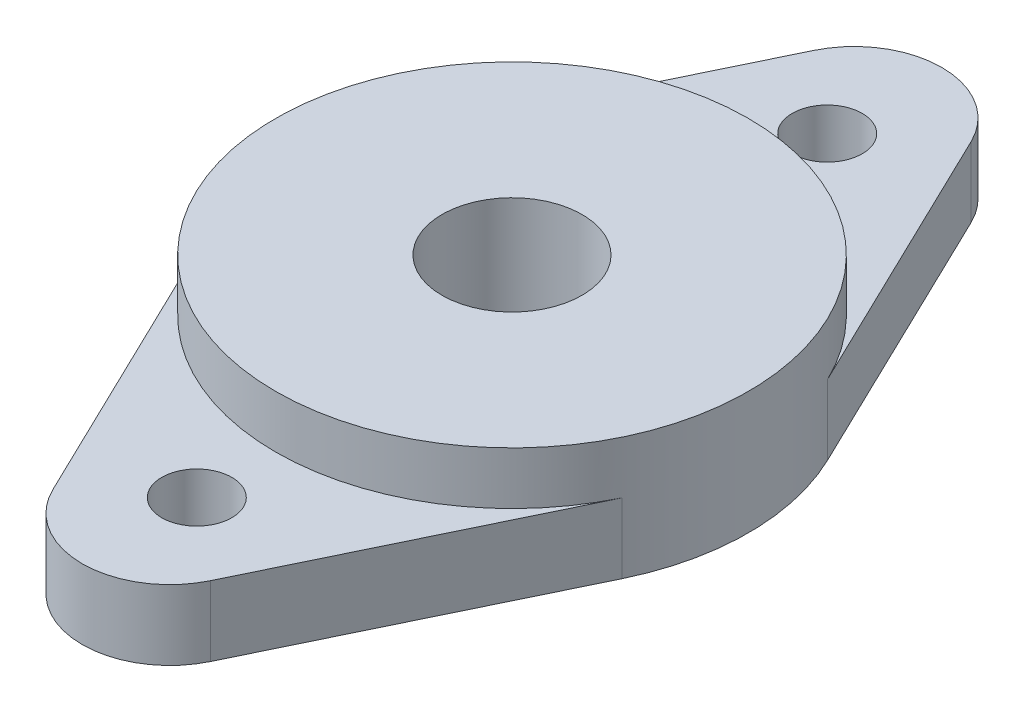
from build123d import *

# Parameters (mm, degrees)
BOSS_EXTRUDE1_DEPTH = 4
SKETCH2_R           = 2
CUT_EXTRUDE1_DEPTH  = 29.296371725
SKETCH3_R           = 13.5
BOSS_EXTRUDE2_DEPTH = 3
SKETCH4_R           = 4
CUT_EXTRUDE2_DEPTH  = 29.87359785


with BuildPart() as part:
    # Sketch1 → Boss-Extrude1 (new body)
    with BuildSketch(Plane(origin=(0, 0, 0), x_dir=(1, 0, 0), z_dir=(0, 1, 0))):
        with BuildLine():
            ThreePointArc((13.5, 0), (13.159823391, 3.011486067), (12.156437284, 5.871203671))
            ThreePointArc((12.156437284, 5.871203671), (0, 13.5), (-12.156437284, 5.871203671))
            ThreePointArc((-12.156437284, 5.871203671), (-13.159823391, 3.011486067), (-13.5, 0))
            Line((-13.5, 0), (13.5, 0))
        make_face()
        with BuildLine():
            ThreePointArc((12.156437284, -5.871203671), (13.159823391, -3.011486067), (13.5, 0))
            Line((13.5, 0), (-13.5, 0))
            ThreePointArc((-13.5, 0), (-13.159823391, -3.011486067), (-12.156437284, -5.871203671))
            ThreePointArc((-12.156437284, -5.871203671), (0, -13.5), (12.156437284, -5.871203671))
        make_face()
        with BuildLine():
            ThreePointArc((-12.156437284, 5.871203671), (0, 13.5), (12.156437284, 5.871203671))
            Line((12.156437284, 5.871203671), (4.502384179, 21.719064136))
            ThreePointArc((4.502384179, 21.719064136), (0, 24.544544258), (-4.502384179, 21.719064136))
            Line((-4.502384179, 21.719064136), (-12.156437284, 5.871203671))
        make_face()
        with BuildLine():
            Line((4.502384179, -21.719064136), (12.156437284, -5.871203671))
            ThreePointArc((12.156437284, -5.871203671), (0, -13.5), (-12.156437284, -5.871203671))
            Line((-12.156437284, -5.871203671), (-4.502384179, -21.719064136))
            ThreePointArc((-4.502384179, -21.719064136), (0, -24.544544258), (4.502384179, -21.719064136))
        make_face()
    extrude(amount=BOSS_EXTRUDE1_DEPTH)

    # Sketch2 → Cut-Extrude1 (cut, through all)
    with BuildSketch(Plane(origin=(0, 4, 0), x_dir=(1, 0, 0), z_dir=(0, 1, 0))):
        with Locations(Location((0, -18, 0), (0, 0, 270))):
            Circle(SKETCH2_R)
        with Locations(Location((0, 18, 0), (0, 0, 270))):
            Circle(SKETCH2_R)
    extrude(amount=-CUT_EXTRUDE1_DEPTH, mode=Mode.SUBTRACT)

    # Sketch3 → Boss-Extrude2 (add)
    with BuildSketch(Plane(origin=(0, 4, 0), x_dir=(1, 0, 0), z_dir=(0, 1, 0))):
        with Locations(Location((0, 0, 0), (0, 0, 25.779183858))):
            Circle(SKETCH3_R)
    extrude(amount=BOSS_EXTRUDE2_DEPTH)

    # Sketch4 → Cut-Extrude2 (cut, through all)
    with BuildSketch(Plane(origin=(0, 7, 0), x_dir=(1, 0, 0), z_dir=(0, 1, 0))):
        with Locations(Location((0, 0, 0), (0, 0, 270))):
            Circle(SKETCH4_R)
    extrude(amount=-CUT_EXTRUDE2_DEPTH, mode=Mode.SUBTRACT)


solid = part.part
